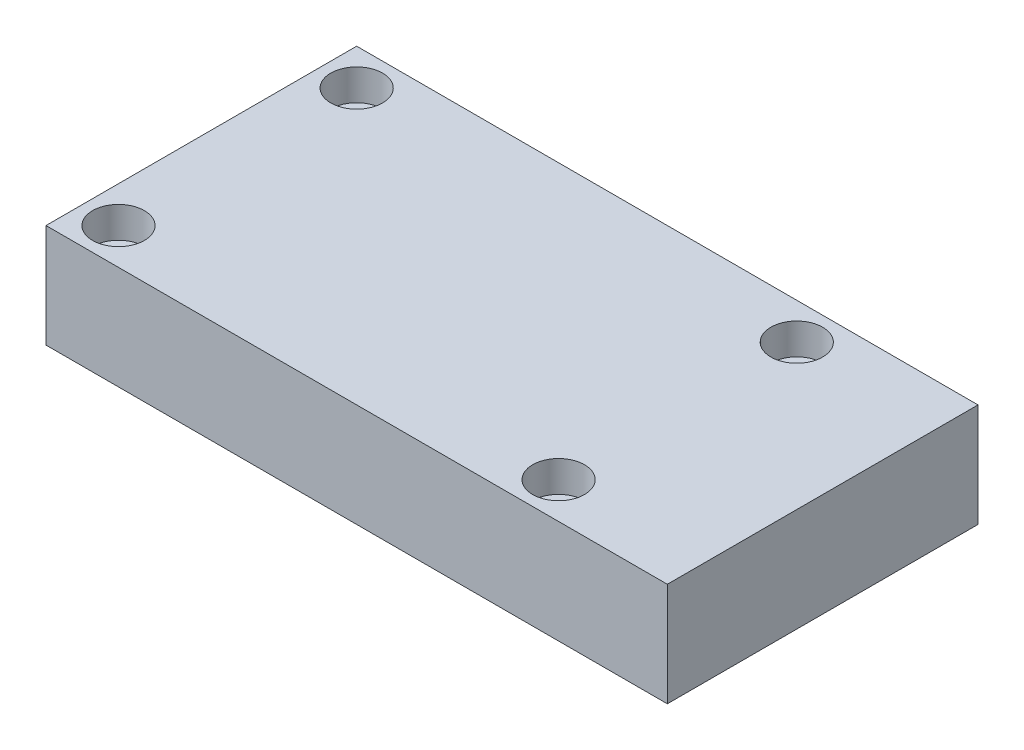
from build123d import *

# Parameters (mm, degrees)
SKETCH1_W           = 152.4
SKETCH1_H           = 76.2
BOSS_EXTRUDE1_DEPTH = 25.4
SKETCH2_R           = 6.35
CUT_EXTRUDE1_DEPTH  = 7.62


with BuildPart() as part:
    # Sketch1 → Boss-Extrude1 (new body)
    with BuildSketch(Plane(origin=(0, 0, 0), x_dir=(1, 0, 0), z_dir=(0, 1, 0))):
        with Locations((20.469773732, -4.266819273)):
            Rectangle(SKETCH1_W, SKETCH1_H)
    extrude(amount=BOSS_EXTRUDE1_DEPTH)

    # Sketch2 → Cut-Extrude1 (cut)
    with BuildSketch(Plane(origin=(0, 25.4, 0), x_dir=(1, 0, 0), z_dir=(0, 1, 0))):
        with Locations(Location((-46.840226268, 24.943180727, 0), (0, 0, 270))):
            Circle(SKETCH2_R)
        with Locations(Location((-46.840226268, -33.476819273, 0), (0, 0, 270))):
            Circle(SKETCH2_R)
        with Locations(Location((61.109773732, 24.943180727, 0), (0, 0, 270))):
            Circle(SKETCH2_R)
        with Locations(Location((61.109773732, -33.476819273, 0), (0, 0, 270))):
            Circle(SKETCH2_R)
    extrude(amount=-CUT_EXTRUDE1_DEPTH, mode=Mode.SUBTRACT)


solid = part.part
